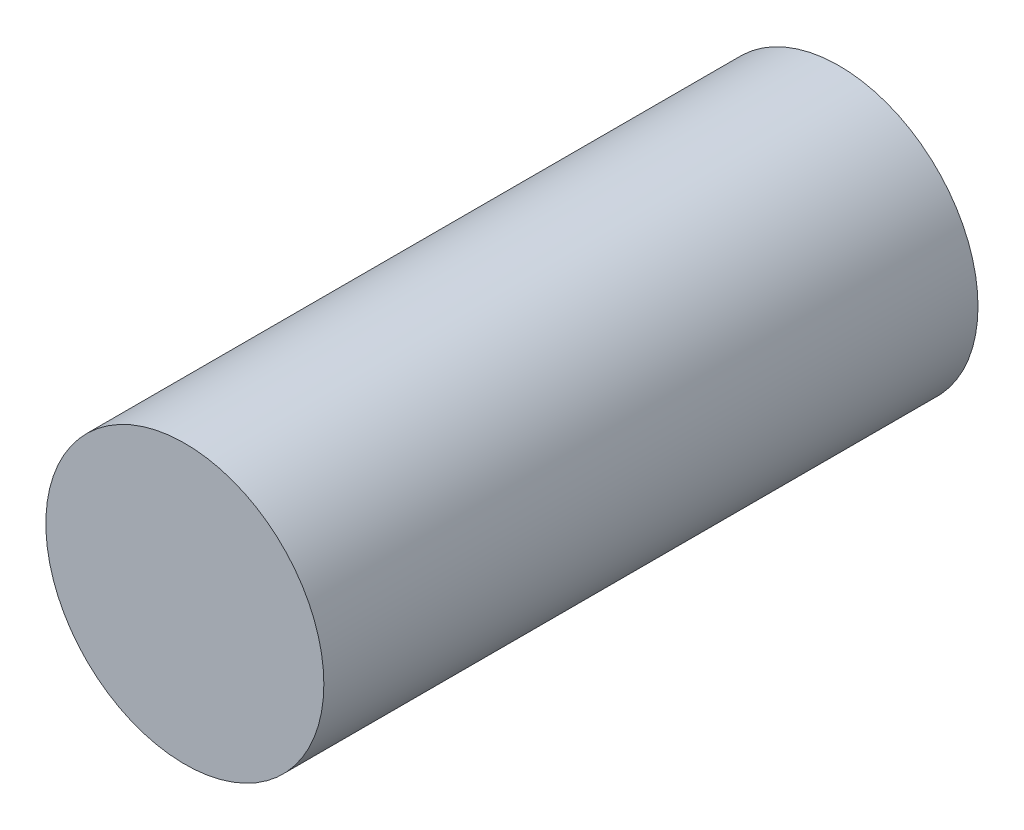
from build123d import *

# Parameters (mm, degrees)
SKETCH1_R           = 17
BOSS_EXTRUDE1_DEPTH = 40
SKETCH2_W           = 10
SKETCH2_H           = 2
BOSS_EXTRUDE2_DEPTH = 5
SKETCH3_R           = 2.5
CUT_EXTRUDE1_DEPTH  = 10


with BuildPart() as part:
    # Sketch1 → Boss-Extrude1 (new, symmetric)
    with BuildSketch(Plane.XY):
        Circle(SKETCH1_R)
    extrude(amount=BOSS_EXTRUDE1_DEPTH, both=True)

    # Sketch2 → Boss-Extrude2 (add, symmetric)
    with BuildSketch(Plane.XY):
        with Locations((0, -17)):
            Rectangle(SKETCH2_W, SKETCH2_H)
    extrude(amount=BOSS_EXTRUDE2_DEPTH, both=True)

    # Sketch3 → Cut-Extrude1 (cut)
    with BuildSketch(Plane.XZ.offset(18)):
        with Locations(Location((0, 0, 0), (0, 0, 270))):
            Circle(SKETCH3_R)
    extrude(amount=-CUT_EXTRUDE1_DEPTH, mode=Mode.SUBTRACT)


solid = part.part
